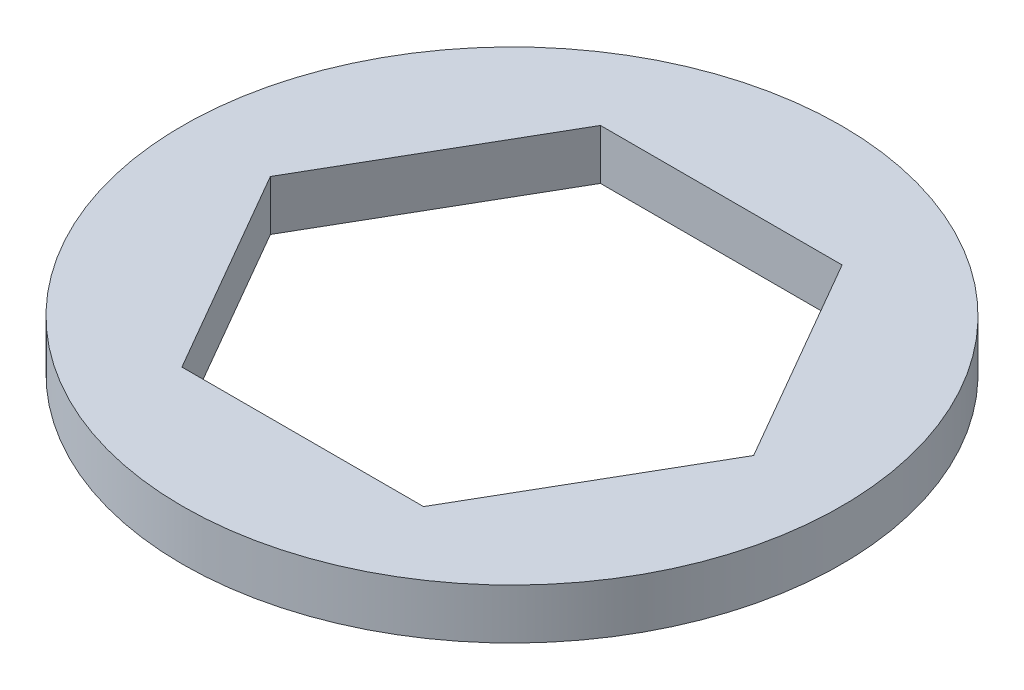
from build123d import *

# Parameters (mm, degrees)
SKETCH1_R           = 10
BOSS_EXTRUDE1_DEPTH = 1.524


with BuildPart() as part:
    # Sketch1 → Boss-Extrude1 (new body)
    with BuildSketch(Plane(origin=(0, 0, 0), x_dir=(1, 0, 0), z_dir=(0, 1, 0))):
        with Locations(Location((0, 0, 0), (0, 0, 90))):
            Circle(SKETCH1_R)
        Polygon((-7.332348419, 0), (-3.666174209, -6.35), (3.666174209, -6.35), (7.332348419, 0), (3.666174209, 6.35), (-3.666174209, 6.35), align=None, mode=Mode.SUBTRACT)
    extrude(amount=BOSS_EXTRUDE1_DEPTH)


solid = part.part
